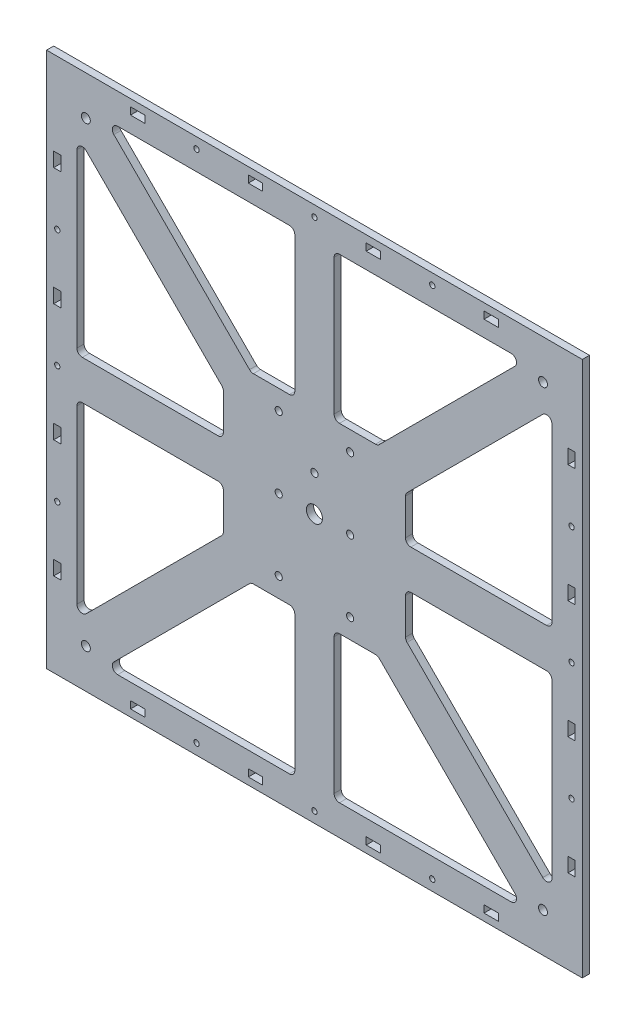
from build123d import *

# Parameters (mm, degrees)
SKETCH_1_R          = 4.5
SKETCH_1_R_2        = 2
EXTRUDE_1_DEPTH     = 4
SKETCH_2_R          = 2
CUT_EXTRUDE_1_DEPTH = 4
SKETCH_3_R          = 1.5
SKETCH_3_W          = 8.03
SKETCH_3_H          = 4.03
SKETCH_3_W_2        = 4.03
SKETCH_3_H_2        = 8.03
CUT_EXTRUDE_2_DEPTH = 4
CUT_EXTRUDE_3_DEPTH = 4
SKETCH_5_R          = 2.5
CUT_EXTRUDE_4_DEPTH = 10


with BuildPart() as part:
    # 草图1 → 凸台-拉伸1 (new body)
    with BuildSketch(Plane.XY):
        Polygon((151.457142857, -41.187142857), (151.457142857, 108.812857143), (-148.542857143, 108.812857143), (-148.542857143, -191.187142857), (151.457142857, -191.187142857), align=None)
        with Locations((1.457142857, -41.187142857)):
            Circle(SKETCH_1_R, mode=Mode.SUBTRACT)
        with Locations((-18.542857143, -41.187142857)):
            Circle(SKETCH_1_R_2, mode=Mode.SUBTRACT)
        with Locations((-18.542857143, -1.187142857)):
            Circle(SKETCH_1_R_2, mode=Mode.SUBTRACT)
        with Locations((21.457142857, -1.187142857)):
            Circle(SKETCH_1_R_2, mode=Mode.SUBTRACT)
        with Locations((21.457142857, -41.187142857)):
            Circle(SKETCH_1_R_2, mode=Mode.SUBTRACT)
        with Locations(Location((21.457142857, -81.187142857, 0), (0, 0, 180))):
            Circle(SKETCH_1_R_2, mode=Mode.SUBTRACT)
        with Locations(Location((-18.542857143, -81.187142857, 0), (0, 0, 180))):
            Circle(SKETCH_1_R_2, mode=Mode.SUBTRACT)
    extrude(amount=EXTRUDE_1_DEPTH)

    # 草图2 → 切除-拉伸1 (cut)
    with BuildSketch(Plane.XY.offset(4)):
        with Locations((1.457142857, -21.187142857)):
            Circle(SKETCH_2_R)
    extrude(amount=-CUT_EXTRUDE_1_DEPTH, mode=Mode.SUBTRACT)

    # 草图3 → 切除-拉伸2 (cut)
    with BuildSketch(Plane.XY.offset(4)):
        with Locations((1.457142857, -185.187142857)):
            Circle(SKETCH_3_R)
        with Locations((67.457142857, -185.187142857)):
            Circle(SKETCH_3_R)
        with Locations(Location((-64.542857143, -185.187142857, 0), (0, 0, 180))):
            Circle(SKETCH_3_R)
        with Locations(Location((-142.542857143, 24.812857143, 0), (0, 0, 180))):
            Circle(SKETCH_3_R)
        with Locations((-142.542857143, -41.187142857)):
            Circle(SKETCH_3_R)
        with Locations((-142.542857143, -107.187142857)):
            Circle(SKETCH_3_R)
        with Locations(Location((67.457142857, 102.812857143, 0), (0, 0, 180))):
            Circle(SKETCH_3_R)
        with Locations((1.457142857, 102.812857143)):
            Circle(SKETCH_3_R)
        with Locations((-64.542857143, 102.812857143)):
            Circle(SKETCH_3_R)
        with Locations(Location((145.457142857, -107.187142857, 0), (0, 0, 180))):
            Circle(SKETCH_3_R)
        with Locations((145.457142857, -41.187142857)):
            Circle(SKETCH_3_R)
        with Locations((145.457142857, 24.812857143)):
            Circle(SKETCH_3_R)
        with Locations((100.457142857, -185.187142857)):
            Rectangle(SKETCH_3_W, SKETCH_3_H)
        with Locations((34.457142857, -185.187142857)):
            Rectangle(SKETCH_3_W, SKETCH_3_H)
        with Locations((-31.542857143, -185.187142857)):
            Rectangle(SKETCH_3_W, SKETCH_3_H)
        with Locations((-97.542857143, -185.187142857)):
            Rectangle(SKETCH_3_W, SKETCH_3_H)
        with Locations((-142.542857143, 57.812857143)):
            Rectangle(SKETCH_3_W_2, SKETCH_3_H_2)
        with Locations((-142.542857143, -8.187142857)):
            Rectangle(SKETCH_3_W_2, SKETCH_3_H_2)
        with Locations((-142.542857143, -74.187142857)):
            Rectangle(SKETCH_3_W_2, SKETCH_3_H_2)
        with Locations((-142.542857143, -140.187142857)):
            Rectangle(SKETCH_3_W_2, SKETCH_3_H_2)
        with Locations((100.457142857, 102.812857143)):
            Rectangle(SKETCH_3_W, SKETCH_3_H)
        with Locations((34.457142857, 102.812857143)):
            Rectangle(SKETCH_3_W, SKETCH_3_H)
        with Locations((-31.542857143, 102.812857143)):
            Rectangle(SKETCH_3_W, SKETCH_3_H)
        with Locations((-97.542857143, 102.812857143)):
            Rectangle(SKETCH_3_W, SKETCH_3_H)
        with Locations((145.457142857, -140.187142857)):
            Rectangle(SKETCH_3_W_2, SKETCH_3_H_2)
        with Locations((145.457142857, -74.187142857)):
            Rectangle(SKETCH_3_W_2, SKETCH_3_H_2)
        with Locations((145.457142857, -8.187142857)):
            Rectangle(SKETCH_3_W_2, SKETCH_3_H_2)
        with Locations((145.457142857, 57.812857143)):
            Rectangle(SKETCH_3_W_2, SKETCH_3_H_2)
    extrude(amount=-CUT_EXTRUDE_2_DEPTH, mode=Mode.SUBTRACT)

    # 草图4 → 切除-拉伸3 (cut)
    with BuildSketch(Plane.XY.offset(4)):
        with BuildLine():
            Line((-9.542857143, 88.812857143), (-9.542857143, 12.812857143))
            ThreePointArc((-9.542857143, 12.812857143), (-10.421536799, 10.691536799), (-12.542857143, 9.812857143))
            Line((-12.542857143, 9.812857143), (-32.74386727, 9.812857143))
            ThreePointArc((-32.74386727, 9.812857143), (-33.891917567, 10.041218545), (-34.865187613, 10.691536799))
            Line((-34.865187613, 10.691536799), (-110.865187613, 86.691536799))
            ThreePointArc((-110.865187613, 86.691536799), (-111.515505867, 89.96090744), (-108.74386727, 91.812857143))
            Line((-108.74386727, 91.812857143), (-12.542857143, 91.812857143))
            ThreePointArc((-12.542857143, 91.812857143), (-10.421536799, 90.934177486), (-9.542857143, 88.812857143))
        make_face()
        with BuildLine():
            Line((12.457142857, 88.812857143), (12.457142857, 12.812857143))
            ThreePointArc((12.457142857, 12.812857143), (13.335822514, 10.691536799), (15.457142857, 9.812857143))
            Line((15.457142857, 9.812857143), (35.658152984, 9.812857143))
            ThreePointArc((35.658152984, 9.812857143), (36.806203281, 10.041218545), (37.779473327, 10.691536799))
            Line((37.779473327, 10.691536799), (113.779473327, 86.691536799))
            ThreePointArc((113.779473327, 86.691536799), (114.429791581, 89.96090744), (111.658152984, 91.812857143))
            Line((111.658152984, 91.812857143), (15.457142857, 91.812857143))
            ThreePointArc((15.457142857, 91.812857143), (13.335822514, 90.934177486), (12.457142857, 88.812857143))
        make_face()
        with BuildLine():
            Line((-12.542857143, -174.187142857), (-108.74386727, -174.187142857))
            ThreePointArc((-108.74386727, -174.187142857), (-111.515505867, -172.335193154), (-110.865187613, -169.065822514))
            Line((-110.865187613, -169.065822514), (-34.865187613, -93.065822514))
            ThreePointArc((-34.865187613, -93.065822514), (-33.891917567, -92.41550426), (-32.74386727, -92.187142857))
            Line((-32.74386727, -92.187142857), (-12.542857143, -92.187142857))
            ThreePointArc((-12.542857143, -92.187142857), (-10.421536799, -93.065822514), (-9.542857143, -95.187142857))
            Line((-9.542857143, -95.187142857), (-9.542857143, -171.187142857))
            ThreePointArc((-9.542857143, -171.187142857), (-10.421536799, -173.308463201), (-12.542857143, -174.187142857))
        make_face()
        with BuildLine():
            Line((-49.542857143, -27.187142857), (-49.542857143, -6.98613273))
            ThreePointArc((-49.542857143, -6.98613273), (-49.771218545, -5.838082433), (-50.421536799, -4.864812387))
            Line((-50.421536799, -4.864812387), (-126.421536799, 71.135187613))
            ThreePointArc((-126.421536799, 71.135187613), (-129.69090744, 71.785505867), (-131.542857143, 69.01386727))
            Line((-131.542857143, 69.01386727), (-131.542857143, -27.187142857))
            ThreePointArc((-131.542857143, -27.187142857), (-130.664177486, -29.308463201), (-128.542857143, -30.187142857))
            Line((-128.542857143, -30.187142857), (-52.542857143, -30.187142857))
            ThreePointArc((-52.542857143, -30.187142857), (-50.421536799, -29.308463201), (-49.542857143, -27.187142857))
        make_face()
        with BuildLine():
            Line((15.457142857, -174.187142857), (111.658152984, -174.187142857))
            ThreePointArc((111.658152984, -174.187142857), (114.429791581, -172.335193154), (113.779473327, -169.065822514))
            Line((113.779473327, -169.065822514), (37.779473327, -93.065822514))
            ThreePointArc((37.779473327, -93.065822514), (36.806203281, -92.41550426), (35.658152984, -92.187142857))
            Line((35.658152984, -92.187142857), (15.457142857, -92.187142857))
            ThreePointArc((15.457142857, -92.187142857), (13.335822514, -93.065822514), (12.457142857, -95.187142857))
            Line((12.457142857, -95.187142857), (12.457142857, -171.187142857))
            ThreePointArc((12.457142857, -171.187142857), (13.335822514, -173.308463201), (15.457142857, -174.187142857))
        make_face()
        with BuildLine():
            Line((129.335822514, 71.135187613), (53.335822514, -4.864812387))
            ThreePointArc((53.335822514, -4.864812387), (52.68550426, -5.838082433), (52.457142857, -6.98613273))
            Line((52.457142857, -6.98613273), (52.457142857, -27.187142857))
            ThreePointArc((52.457142857, -27.187142857), (53.335822514, -29.308463201), (55.457142857, -30.187142857))
            Line((55.457142857, -30.187142857), (131.457142857, -30.187142857))
            ThreePointArc((131.457142857, -30.187142857), (133.578463201, -29.308463201), (134.457142857, -27.187142857))
            Line((134.457142857, -27.187142857), (134.457142857, 69.01386727))
            ThreePointArc((134.457142857, 69.01386727), (132.605193154, 71.785505867), (129.335822514, 71.135187613))
        make_face()
        with BuildLine():
            Line((52.457142857, -55.187142857), (52.457142857, -75.388152984))
            ThreePointArc((52.457142857, -75.388152984), (52.68550426, -76.536203281), (53.335822514, -77.509473327))
            Line((53.335822514, -77.509473327), (129.335822514, -153.509473327))
            ThreePointArc((129.335822514, -153.509473327), (132.605193154, -154.159791581), (134.457142857, -151.388152984))
            Line((134.457142857, -151.388152984), (134.457142857, -55.187142857))
            ThreePointArc((134.457142857, -55.187142857), (133.578463201, -53.065822514), (131.457142857, -52.187142857))
            Line((131.457142857, -52.187142857), (55.457142857, -52.187142857))
            ThreePointArc((55.457142857, -52.187142857), (53.335822514, -53.065822514), (52.457142857, -55.187142857))
        make_face()
        with BuildLine():
            Line((-126.421536799, -153.509473327), (-50.421536799, -77.509473327))
            ThreePointArc((-50.421536799, -77.509473327), (-49.771218545, -76.536203281), (-49.542857143, -75.388152984))
            Line((-49.542857143, -75.388152984), (-49.542857143, -55.187142857))
            ThreePointArc((-49.542857143, -55.187142857), (-50.421536799, -53.065822514), (-52.542857143, -52.187142857))
            Line((-52.542857143, -52.187142857), (-128.542857143, -52.187142857))
            ThreePointArc((-128.542857143, -52.187142857), (-130.664177486, -53.065822514), (-131.542857143, -55.187142857))
            Line((-131.542857143, -55.187142857), (-131.542857143, -151.388152984))
            ThreePointArc((-131.542857143, -151.388152984), (-129.69090744, -154.159791581), (-126.421536799, -153.509473327))
        make_face()
    extrude(amount=-CUT_EXTRUDE_3_DEPTH, mode=Mode.SUBTRACT)

    # 草图5 → 切除-拉伸4 (cut)
    with BuildSketch(Plane.XY.offset(4)):
        with Locations((-126.542857143, 86.812857143)):
            Circle(SKETCH_5_R)
        with Locations((129.457142857, 86.812857143)):
            Circle(SKETCH_5_R)
        with Locations((129.457142857, -169.187142857)):
            Circle(SKETCH_5_R)
        with Locations((-126.542857143, -169.187142857)):
            Circle(SKETCH_5_R)
    extrude(amount=-CUT_EXTRUDE_4_DEPTH, mode=Mode.SUBTRACT)


solid = part.part
